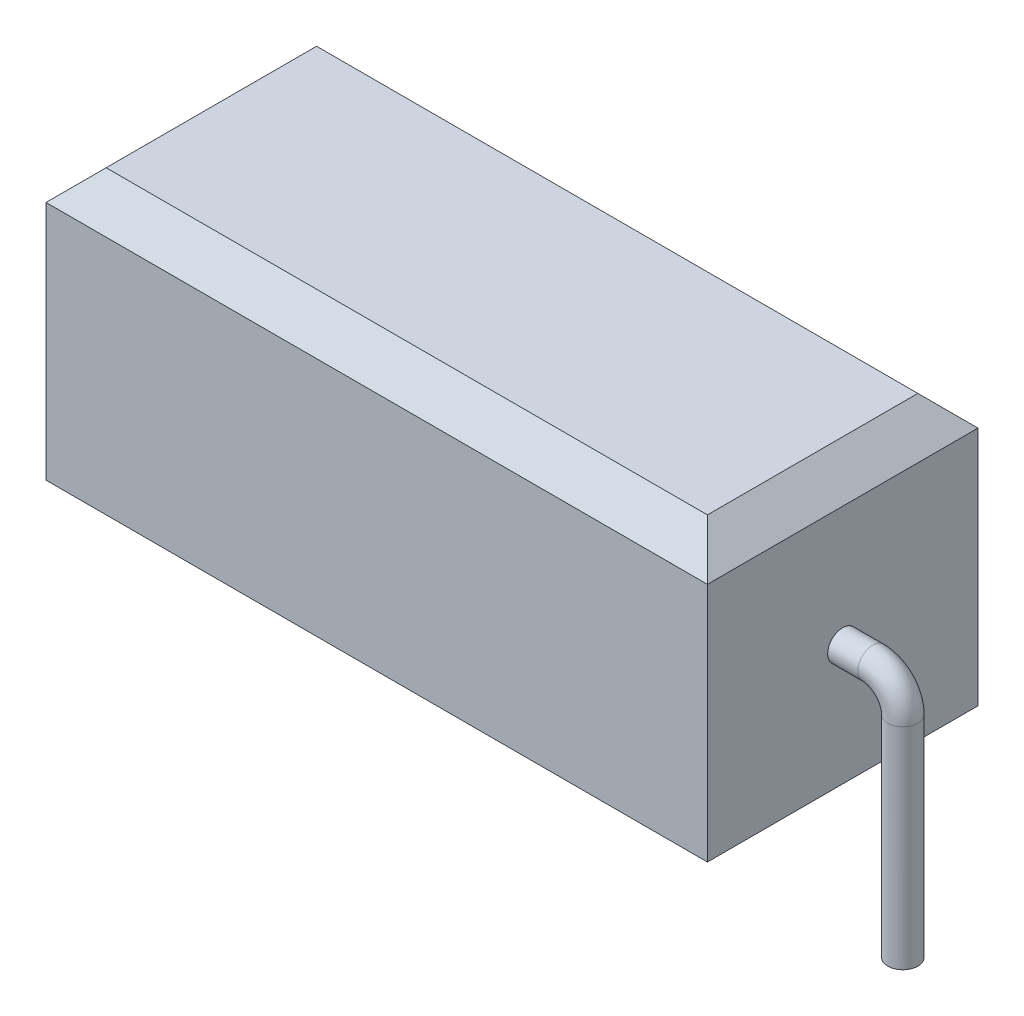
from build123d import *

# Parameters (mm, degrees)
SKETCH_1_W        = 22
SKETCH_1_H        = 9
EXTRUDE_1_DEPTH   = 5
CHAMFER_1_SIZE    = 1
SWEEP_1_PROFILE_R = 0.5
SWEEP_2_PROFILE_R = 0.5


with BuildPart() as part:
    # 草图1 → 凸台-拉伸1 (new, symmetric)
    with BuildSketch(Plane(origin=(0, 0, 0), x_dir=(1, 0, 0), z_dir=(0, 1, 0))):
        Rectangle(SKETCH_1_W, SKETCH_1_H)
    extrude(amount=EXTRUDE_1_DEPTH, both=True)

    # 倒角1
    chamfer_1_edges = [part.edges().sort_by_distance(p)[0] for p in [
        (-11, 5, 0),
        (0, 5, 4.5),
        (11, 5, 0),
        (0, -5, 4.5),
        (-11, -5, 0),
        (0, -5, -4.5),
        (11, -5, 0),
        (0, 5, -4.5),
    ]]
    chamfer(chamfer_1_edges, length=CHAMFER_1_SIZE)

    # 扫描1: sweep along a path in 草图2
    with BuildLine(Plane.XY) as sweep_1_path:
        Line((11, 0), (12, 0))
        ThreePointArc((12, 0), (12.707106781, -0.292893219), (13, -1))
        Line((13, -1), (13, -8))
    # 扫描1 profile (on start of the path) → 扫描1 (sweep)
    with BuildSketch(Plane.YZ.offset(11)):
        Circle(SWEEP_1_PROFILE_R)
    sweep(path=sweep_1_path.line)

    # 扫描2: sweep along a path in 草图9
    with BuildLine(Plane.XY) as sweep_2_path:
        Line((-11, 0), (-12, 0))
        ThreePointArc((-12, 0), (-12.707106781, -0.292893219), (-13, -1))
        Line((-13, -1), (-13, -8))
    # 扫描2 profile (on start of the path) → 扫描2 (sweep)
    with BuildSketch(Plane(origin=(-11, 0, 0), x_dir=(0, -1, 0), z_dir=(-1, 0, 0))):
        Circle(SWEEP_2_PROFILE_R)
    sweep(path=sweep_2_path.line)


solid = part.part
